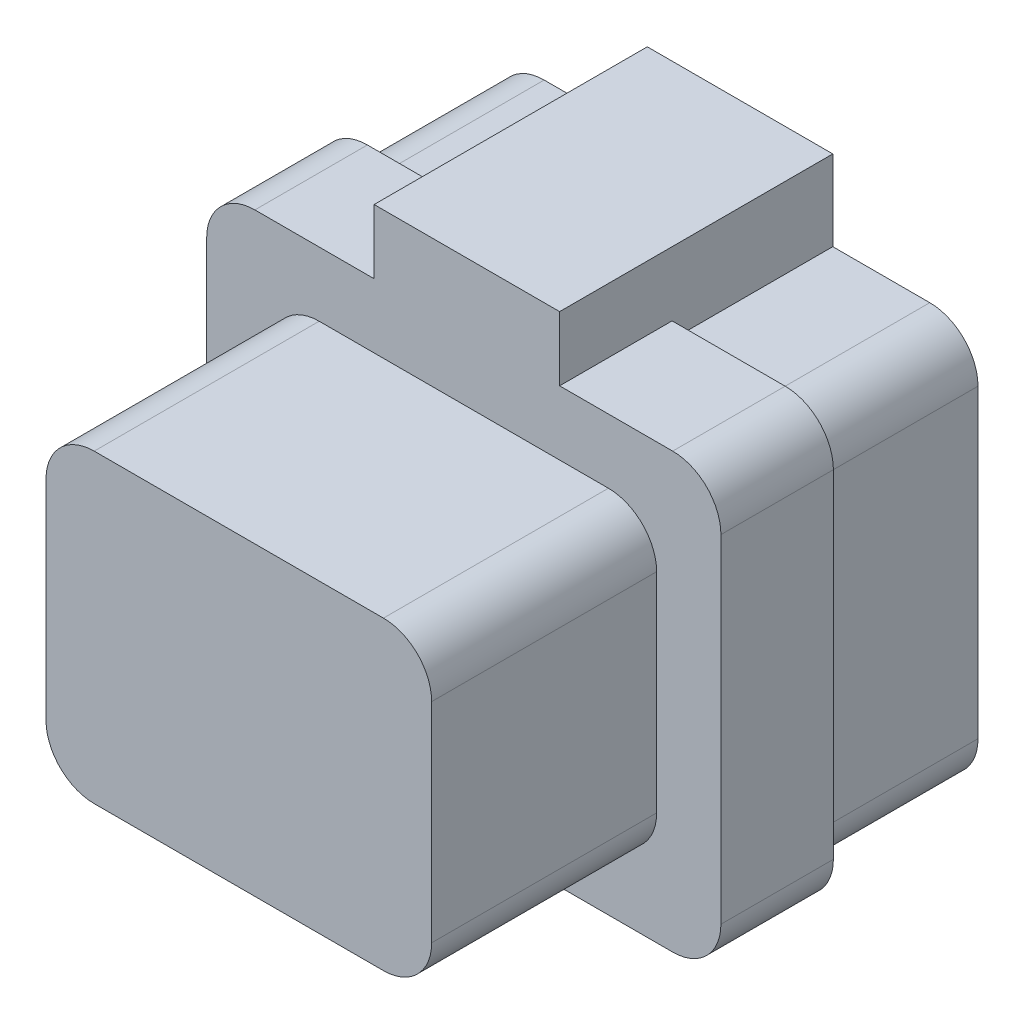
from build123d import *

# Parameters (mm, degrees)
SKETCH_1_W          = 32
SKETCH_1_H          = 27
EXTRUDE_1_DEPTH     = 7
SKETCH_2_W          = 24
SKETCH_2_H          = 19
EXTRUDE_2_DEPTH     = 14
SKETCH_3_W          = 30
SKETCH_3_H          = 25
EXTRUDE_3_DEPTH     = 10
FILLET_1_R          = 3
SKETCH_4_W          = 11.544617985
SKETCH_4_H          = 17
EXTRUDE_4_DEPTH     = 5
SKETCH_5_R          = 0.4
CUT_EXTRUDE_1_DEPTH = 1


with BuildPart() as part:
    # ｽｹｯﾁ1 → ﾎﾞｽ - 押し出し1 (new body)
    with BuildSketch(Plane.XY):
        with Locations((16, 13.5)):
            Rectangle(SKETCH_1_W, SKETCH_1_H)
    extrude(amount=EXTRUDE_1_DEPTH)

    # ｽｹｯﾁ2 → ﾎﾞｽ - 押し出し2 (add)
    with BuildSketch(Plane.XY.offset(7)):
        with Locations((16, 13.5)):
            Rectangle(SKETCH_2_W, SKETCH_2_H)
    extrude(amount=EXTRUDE_2_DEPTH)

    # ｽｹｯﾁ3 → ﾎﾞｽ - 押し出し3 (add)
    with BuildSketch(Plane(origin=(0, 0, 0), x_dir=(-1, 0, 0), z_dir=(0, 0, -1))):
        with Locations((-16, 13.5)):
            Rectangle(SKETCH_3_W, SKETCH_3_H)
    extrude(amount=EXTRUDE_3_DEPTH)

    # ﾌｨﾚｯﾄ1
    fillet_1_edges = [part.edges().sort_by_distance(p)[0] for p in [
        (28, 23, 14),
        (4, 23, 14),
        (4, 4, 14),
        (28, 4, 14),
        (31, 1, -5),
        (1, 1, -5),
        (1, 26, -5),
        (31, 26, -5),
        (0, 27, 3.5),
        (32, 27, 3.5),
        (32, 0, 3.5),
        (0, 0, 3.5),
    ]]
    fillet(fillet_1_edges, radius=FILLET_1_R)

    # ｽｹｯﾁ4 → ﾎﾞｽ - 押し出し4 (add)
    with BuildSketch(Plane(origin=(0, 26, 0), x_dir=(1, 0, 0), z_dir=(0, 1, 0))):
        with Locations((16.191136059, 1.5)):
            Rectangle(SKETCH_4_W, SKETCH_4_H)
    extrude(amount=EXTRUDE_4_DEPTH)

    # ｽｹｯﾁ5 → ｶｯﾄ - 押し出し1 (cut)
    with BuildSketch(Plane(origin=(0, 0, -10), x_dir=(-1, 0, 0), z_dir=(0, 0, -1))):
        with Locations((-16.191136059, 13)):
            Circle(SKETCH_5_R)
        with Locations((-14.191136059, 13)):
            Circle(SKETCH_5_R)
        with Locations((-12.191136059, 13)):
            Circle(SKETCH_5_R)
        with Locations((-10.191136059, 13)):
            Circle(SKETCH_5_R)
        with Locations((-8.191136059, 13)):
            Circle(SKETCH_5_R)
        with Locations((-6.191136059, 13)):
            Circle(SKETCH_5_R)
        with Locations((-16.191136059, 18)):
            Circle(SKETCH_5_R)
        with Locations((-14.191136059, 18)):
            Circle(SKETCH_5_R)
        with Locations((-12.191136059, 18)):
            Circle(SKETCH_5_R)
        with Locations((-10.191136059, 18)):
            Circle(SKETCH_5_R)
        with Locations((-8.191136059, 18)):
            Circle(SKETCH_5_R)
        with Locations((-6.191136059, 18)):
            Circle(SKETCH_5_R)
        with Locations((-16.191136059, 8)):
            Circle(SKETCH_5_R)
        with Locations((-14.191136059, 8)):
            Circle(SKETCH_5_R)
        with Locations((-12.191136059, 8)):
            Circle(SKETCH_5_R)
        with Locations((-10.191136059, 8)):
            Circle(SKETCH_5_R)
        with Locations((-8.191136059, 8)):
            Circle(SKETCH_5_R)
        with Locations((-6.191136059, 8)):
            Circle(SKETCH_5_R)
        with Locations((-26.191136059, 18)):
            Circle(SKETCH_5_R)
        with Locations((-24.191136059, 18)):
            Circle(SKETCH_5_R)
        with Locations((-22.191136059, 18)):
            Circle(SKETCH_5_R)
        with Locations((-20.191136059, 18)):
            Circle(SKETCH_5_R)
        with Locations((-18.191136059, 13)):
            Circle(SKETCH_5_R)
        with Locations((-20.191136059, 13)):
            Circle(SKETCH_5_R)
        with Locations((-22.191136059, 13)):
            Circle(SKETCH_5_R)
        with Locations((-24.191136059, 13)):
            Circle(SKETCH_5_R)
        with Locations((-26.191136059, 13)):
            Circle(SKETCH_5_R)
        with Locations((-26.191136059, 8)):
            Circle(SKETCH_5_R)
        with Locations((-24.191136059, 8)):
            Circle(SKETCH_5_R)
        with Locations((-22.191136059, 8)):
            Circle(SKETCH_5_R)
        with Locations((-20.191136059, 8)):
            Circle(SKETCH_5_R)
        with Locations((-18.191136059, 8)):
            Circle(SKETCH_5_R)
        with Locations((-18.191136059, 18)):
            Circle(SKETCH_5_R)
    extrude(amount=-CUT_EXTRUDE_1_DEPTH, mode=Mode.SUBTRACT)


solid = part.part
